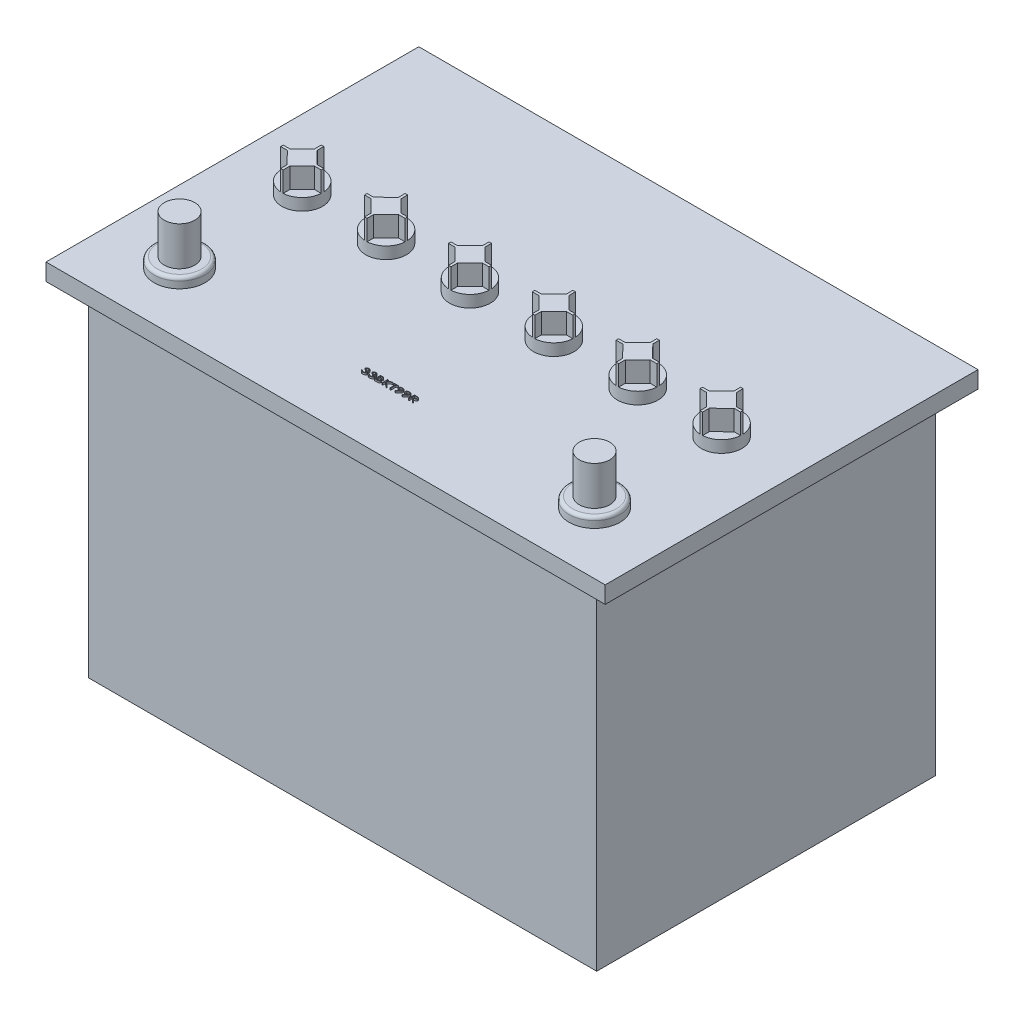
from build123d import *

# Parameters (mm, degrees)
SKETCH1_W           = 300
SKETCH1_H           = 200
BOSS_EXTRUDE1_DEPTH = 200
SKETCH2_W           = 330
SKETCH2_H           = 220
BOSS_EXTRUDE2_DEPTH = 10
SKETCH3_R           = 15
BOSS_EXTRUDE4_DEPTH = 6
FILLET1_R           = 2
SKETCH4_R           = 9
BOSS_EXTRUDE5_DEPTH = 23
SKETCH5_R           = 12
BOSS_EXTRUDE6_DEPTH = 7
BOSS_EXTRUDE7_DEPTH = 12
LPATTERN1_COUNT     = 6
LPATTERN1_PITCH     = 49.5
BOSS_EXTRUDE8_DEPTH = 1


with BuildPart() as part:
    # Sketch1 → Boss-Extrude1 (new body)
    with BuildSketch(Plane(origin=(0, 0, 0), x_dir=(1, 0, 0), z_dir=(0, 1, 0))):
        Rectangle(SKETCH1_W, SKETCH1_H)
    extrude(amount=BOSS_EXTRUDE1_DEPTH)

    # Sketch2 → Boss-Extrude2 (add)
    with BuildSketch(Plane(origin=(0, 200, 0), x_dir=(1, 0, 0), z_dir=(0, 1, 0))):
        Rectangle(SKETCH2_W, SKETCH2_H)
    extrude(amount=BOSS_EXTRUDE2_DEPTH)

    # Sketch3 → Boss-Extrude4 (add)
    with BuildSketch(Plane(origin=(0, 210, 0), x_dir=(1, 0, 0), z_dir=(0, 1, 0))):
        with Locations((-122.450147056, -73.740696293)):
            Circle(SKETCH3_R)
        with Locations((122.450147056, -73.740696293)):
            Circle(SKETCH3_R)
    extrude(amount=BOSS_EXTRUDE4_DEPTH)

    # Fillet1
    fillet1_edges = [part.edges().sort_by_distance(p)[0] for p in [
        (-137.450147056, 216, 73.740696293),
        (107.450147056, 216, 73.740696293),
    ]]
    fillet(fillet1_edges, radius=FILLET1_R)

    # Sketch4 → Boss-Extrude5 (add)
    with BuildSketch(Plane(origin=(0, 216, 0), x_dir=(1, 0, 0), z_dir=(0, 1, 0))):
        with Locations((-122.450147056, -73.740696293)):
            Circle(SKETCH4_R)
        with Locations((122.450147056, -73.740696293)):
            Circle(SKETCH4_R)
    extrude(amount=BOSS_EXTRUDE5_DEPTH)

    # Sketch5 → Boss-Extrude6 (add)
    with BuildSketch(Plane(origin=(0, 210, 0), x_dir=(1, 0, 0), z_dir=(0, 1, 0))):
        with Locations((-123.803187355, 0)):
            Circle(SKETCH5_R)
    boss_extrude6 = extrude(amount=BOSS_EXTRUDE6_DEPTH)

    # Sketch6 → Boss-Extrude7 (add)
    with BuildSketch(Plane(origin=(0, 217, 0), x_dir=(1, 0, 0), z_dir=(0, 1, 0))):
        with BuildLine():
            Line((-123.053187355, -11.976539567), (-123.053187355, -8.050654788))
            Line((-123.053187355, -8.050654788), (-115.67552533, -0.75))
            Line((-115.67552533, -0.75), (-111.826647788, -0.75))
            ThreePointArc((-111.826647788, -0.75), (-111.809053897, -0.375183419), (-111.803187355, 0))
            ThreePointArc((-111.803187355, 0), (-111.809053897, 0.375183419), (-111.826647788, 0.75))
            Line((-111.826647788, 0.75), (-115.752532567, 0.75))
            Line((-115.752532567, 0.75), (-123.053187355, 8.127662025))
            Line((-123.053187355, 8.127662025), (-123.053187355, 11.976539567))
            ThreePointArc((-123.053187355, 11.976539567), (-123.803187355, 12), (-124.553187355, 11.976539567))
            Line((-124.553187355, 11.976539567), (-124.553187355, 8.050654788))
            Line((-124.553187355, 8.050654788), (-131.93084938, 0.75))
            Line((-131.93084938, 0.75), (-135.779726922, 0.75))
            ThreePointArc((-135.779726922, 0.75), (-135.803187355, 0), (-135.779726922, -0.75))
            Line((-135.779726922, -0.75), (-131.853842143, -0.75))
            Line((-131.853842143, -0.75), (-124.553187355, -8.127662025))
            Line((-124.553187355, -8.127662025), (-124.553187355, -11.976539567))
            ThreePointArc((-124.553187355, -11.976539567), (-123.803187355, -12), (-123.053187355, -11.976539567))
        make_face()
    boss_extrude7 = extrude(amount=BOSS_EXTRUDE7_DEPTH)

    # LPattern1: Boss-Extrude6, Boss-Extrude7 ×6
    with Locations(*[(i * LPATTERN1_PITCH, 0, 0) for i in range(1, LPATTERN1_COUNT)]):
        add(boss_extrude6)
        add(boss_extrude7)

    # Sketch7 → Boss-Extrude8 (add)
    # profile 1 of 8: a face of its own
    with BuildSketch(Plane(origin=(0, 210, 0), x_dir=(1, 0, 0), z_dir=(0, 1, 0))):
        with BuildLine():
            Line((-15.233974359, -71.048388601), (-15.682692308, -71.048388601))
            add(Edge.make_bspline(
                [(-15.682692308, -71.048388601), (-15.670740797, -71.013071054), (-15.647217894, -70.943559232), (-15.600733136, -70.844818085), (-15.547640338, -70.751918802), (-15.486285946, -70.665359307), (-15.417359401, -70.584735136), (-15.339582974, -70.511439047), (-15.255587111, -70.442769775), (-15.163224815, -70.382241602), (-15.065619562, -70.327641954), (-14.962597136, -70.280538044), (-14.855216605, -70.240691164), (-14.743774295, -70.207625051), (-14.62797021, -70.182406737), (-14.507828051, -70.164378443), (-14.383276247, -70.152727645), (-14.298704059, -70.151549075), (-14.255909455, -70.150952704)],
                knots=[0, 0, 0, 0, 0.987395802, 1.943387521, 2.886756667, 3.819863718, 4.750954218, 5.692797287, 6.648467947, 7.622447263, 8.61503523, 9.609958543, 10.621192064, 11.648084714, 12.688006362, 13.75927082, 14.866162522, 16, 16, 16, 16], degree=3))
            add(Edge.make_bspline(
                [(-14.255909455, -70.150952704), (-14.193431167, -70.152332866), (-14.070110236, -70.155057058), (-13.888705216, -70.179717869), (-13.713907524, -70.218986922), (-13.573717582, -70.264192906), (-13.467207174, -70.308617612), (-13.391067042, -70.34305882), (-13.320581247, -70.382049974), (-13.253954014, -70.422332564), (-13.193235137, -70.467034288), (-13.136011237, -70.512959487), (-13.084020891, -70.562457436), (-13.036508428, -70.613841595), (-12.99437224, -70.667480536), (-12.9571602, -70.721597028), (-12.926271008, -70.776977642), (-12.899788925, -70.832162217), (-12.880367591, -70.888492364), (-12.866036971, -70.945214623), (-12.857433592, -71.00255075), (-12.856322276, -71.041115824), (-12.855769231, -71.060307672)],
                knots=[0, 0, 0, 0, 2.043593356, 4.033686668, 5.977997248, 7.900604975, 8.843597342, 9.753736761, 10.633223357, 11.477908549, 12.299356845, 13.098393349, 13.877379877, 14.645936116, 15.386433903, 16.107606327, 16.792466876, 17.459591995, 18.107775728, 18.73839817, 19.37216588, 20, 20, 20, 20], degree=3))
            add(Edge.make_bspline(
                [(-12.855769231, -71.060307672), (-12.857528191, -71.097388075), (-12.860993248, -71.170434463), (-12.888477863, -71.277100118), (-12.935277209, -71.37670339), (-12.998256646, -71.471588005), (-13.081353294, -71.558500712), (-13.181089744, -71.640240904), (-13.299268446, -71.715488868), (-13.386516322, -71.758100851), (-13.432091346, -71.780359755)],
                knots=[0, 0, 0, 0, 0.909006552, 1.790693694, 2.680934351, 3.598526391, 4.572130129, 5.619037134, 6.756274147, 8, 8, 8, 8], degree=3))
            add(Edge.make_bspline(
                [(-13.432091346, -71.780359755), (-13.381608431, -71.798167835), (-13.283172935, -71.832891407), (-13.146581206, -71.902630867), (-13.022688891, -71.982610047), (-12.951274694, -72.047195428), (-12.916065705, -72.07903764)],
                knots=[0, 0, 0, 0, 1.067287181, 2.081079182, 3.053923925, 4, 4, 4, 4], degree=3))
            add(Edge.make_bspline(
                [(-12.916065705, -72.07903764), (-12.893443498, -72.102023386), (-12.848997983, -72.147183142), (-12.790942333, -72.219958984), (-12.742100658, -72.295328123), (-12.7010375, -72.371923819), (-12.670156065, -72.451401902), (-12.647352029, -72.532557337), (-12.633699365, -72.616099838), (-12.632174642, -72.672605068), (-12.631410256, -72.700932672)],
                knots=[0, 0, 0, 0, 1.099948183, 2.161051958, 3.169675653, 4.161353964, 5.12096266, 6.072886245, 7.033885631, 8, 8, 8, 8], degree=3))
            add(Edge.make_bspline(
                [(-12.631410256, -72.700932672), (-12.632142692, -72.725502491), (-12.633606302, -72.774599847), (-12.643661295, -72.847866306), (-12.660418145, -72.920202344), (-12.684694428, -72.991680043), (-12.715573059, -73.062179679), (-12.75271237, -73.132056865), (-12.797722365, -73.200094761), (-12.847443587, -73.267975359), (-12.904314459, -73.332824059), (-12.966189264, -73.394321215), (-13.031835415, -73.453269821), (-13.104283818, -73.506080252), (-13.180322867, -73.556959526), (-13.262146423, -73.60299174), (-13.348330533, -73.64598609), (-13.439345179, -73.68417656), (-13.534111238, -73.718576363), (-13.631901511, -73.748613478), (-13.732507758, -73.773988779), (-13.836005107, -73.794197841), (-13.942225468, -73.810171188), (-14.051189368, -73.822243308), (-14.162796001, -73.829402434), (-14.238137342, -73.830091421), (-14.276241987, -73.830439883)],
                knots=[0, 0, 0, 0, 0.802535276, 1.603689438, 2.411112196, 3.224719437, 4.065802075, 4.923117297, 5.80615366, 6.728417717, 7.669976847, 8.620101664, 9.577468368, 10.54858692, 11.545910617, 12.564828854, 13.613015613, 14.69067659, 15.787130798, 16.905245909, 18.031049677, 19.174957855, 20.348618168, 21.539068275, 22.755358892, 24, 24, 24, 24], degree=3))
            add(Edge.make_bspline(
                [(-14.276241987, -73.830439883), (-14.327209222, -73.829574753), (-14.427182358, -73.827877784), (-14.573865178, -73.816266057), (-14.713815863, -73.794930896), (-14.847336002, -73.766316771), (-14.974724244, -73.730049776), (-15.095698636, -73.685075325), (-15.210290082, -73.631911008), (-15.317631405, -73.570074758), (-15.41756534, -73.500951749), (-15.508410665, -73.423180439), (-15.591030213, -73.338495553), (-15.663154614, -73.245007681), (-15.727840798, -73.145031412), (-15.782021456, -73.036650775), (-15.82854396, -72.920959609), (-15.850820967, -72.83978011), (-15.862179487, -72.798388601)],
                knots=[0, 0, 0, 0, 1.190413464, 2.335017149, 3.433541733, 4.494537452, 5.522499046, 6.524257344, 7.505961173, 8.46940599, 9.414302072, 10.339698554, 11.258454567, 12.172381962, 13.09300084, 14.035291832, 14.998241702, 16, 16, 16, 16], degree=3))
            Line((-15.862179487, -72.798388601), (-15.413461538, -72.798388601))
            add(Edge.make_bspline(
                [(-15.413461538, -72.798388601), (-15.402610397, -72.825426573), (-15.381361657, -72.878372414), (-15.34391811, -72.953479581), (-15.303593137, -73.023129294), (-15.25900034, -73.086272843), (-15.212134598, -73.144604283), (-15.160610716, -73.196051413), (-15.10682979, -73.243466551), (-15.067213045, -73.269294928), (-15.047475962, -73.28216264)],
                knots=[0, 0, 0, 0, 1.132145232, 2.216970274, 3.259385698, 4.257467278, 5.219503243, 6.163874548, 7.085241318, 8, 8, 8, 8], degree=3))
            add(Edge.make_bspline(
                [(-15.047475962, -73.28216264), (-15.02130278, -73.297336282), (-14.968424688, -73.327991832), (-14.883568649, -73.366253318), (-14.794044159, -73.399625783), (-14.698713433, -73.424788154), (-14.598948926, -73.446462119), (-14.493439366, -73.460565593), (-14.382757357, -73.470150658), (-14.30711319, -73.471021392), (-14.268529647, -73.471465524)],
                knots=[0, 0, 0, 0, 0.893867431, 1.805894493, 2.74799246, 3.71511807, 4.717865955, 5.764337694, 6.859663948, 8, 8, 8, 8], degree=3))
            add(Edge.make_bspline(
                [(-14.268529647, -73.471465524), (-14.224799894, -73.470856874), (-14.13954535, -73.469670262), (-14.015062193, -73.458576646), (-13.896825604, -73.442545327), (-13.785476264, -73.417568613), (-13.680300106, -73.387393102), (-13.582607911, -73.348225483), (-13.490839971, -73.303568087), (-13.406512402, -73.251885636), (-13.330632469, -73.195617139), (-13.264190838, -73.136493819), (-13.207361436, -73.075290436), (-13.160773847, -73.011400329), (-13.124179195, -72.944844781), (-13.099128307, -72.875486708), (-13.082707311, -72.804062462), (-13.080990297, -72.755475733), (-13.080128205, -72.731080909)],
                knots=[0, 0, 0, 0, 1.360353189, 2.652113973, 3.886216181, 5.070148789, 6.199935678, 7.286998849, 8.340713861, 9.372136105, 10.359685652, 11.276421392, 12.135904893, 12.953384407, 13.731082342, 14.490303206, 15.241999049, 16, 16, 16, 16], degree=3))
            add(Edge.make_bspline(
                [(-13.080128205, -72.731080909), (-13.081907608, -72.698339738), (-13.085495534, -72.632321603), (-13.118784192, -72.536242774), (-13.170096625, -72.443626677), (-13.241811825, -72.35670147), (-13.328949121, -72.275929202), (-13.430962511, -72.204459593), (-13.547276758, -72.145018132), (-13.654364126, -72.104566674), (-13.749592727, -72.076842672), (-13.831503524, -72.058025465), (-13.922911694, -72.042496001), (-14.023374468, -72.027510777), (-14.133302373, -72.015173675), (-14.252531119, -72.00474647), (-14.381101131, -71.996296645), (-14.469975677, -71.992607703), (-14.516025641, -71.990696293)],
                knots=[0, 0, 0, 0, 0.882729801, 1.779905068, 2.718893252, 3.73432288, 4.811844334, 5.923218651, 7.090383321, 8.334298397, 9.012158468, 9.770864905, 10.605040525, 11.5182922, 12.516811851, 13.595148151, 14.753936343, 16, 16, 16, 16], degree=3))
            Line((-14.516025641, -71.990696293), (-14.516025641, -71.631721934))
            add(Edge.make_bspline(
                [(-14.516025641, -71.631721934), (-14.457785961, -71.630978356), (-14.34364219, -71.62952102), (-14.176551432, -71.612253104), (-14.017002894, -71.588060297), (-13.890297612, -71.55756793), (-13.795044002, -71.527756888), (-13.728384908, -71.50615012), (-13.66763716, -71.481211903), (-13.611397771, -71.456126668), (-13.560793215, -71.428822555), (-13.514422133, -71.400930038), (-13.474038742, -71.370588481), (-13.426779283, -71.330474233), (-13.37946198, -71.276088493), (-13.33539176, -71.207491482), (-13.309599023, -71.134049468), (-13.306184969, -71.08386292), (-13.304487179, -71.058905428)],
                knots=[0, 0, 0, 0, 1.917665882, 3.758427453, 5.527810254, 7.230694856, 8.044036591, 8.815763194, 9.537693509, 10.206039437, 10.843197722, 11.430754734, 11.98658976, 12.505134745, 13.470512697, 14.348572317, 15.178754166, 16, 16, 16, 16], degree=3))
            add(Edge.make_bspline(
                [(-13.304487179, -71.058905428), (-13.305308045, -71.040611159), (-13.306948433, -71.004052537), (-13.319847554, -70.950422633), (-13.341854614, -70.89918333), (-13.370171945, -70.848888171), (-13.409228766, -70.801813261), (-13.455579443, -70.75634835), (-13.510126643, -70.712398299), (-13.573061027, -70.671968535), (-13.641513759, -70.633382023), (-13.715637782, -70.600626763), (-13.793862499, -70.572430734), (-13.876544531, -70.549276263), (-13.96379376, -70.53200663), (-14.055327524, -70.519418955), (-14.151308041, -70.511618119), (-14.216865554, -70.510498221), (-14.250300481, -70.509927063)],
                knots=[0, 0, 0, 0, 0.732615433, 1.464032802, 2.194490306, 2.962292955, 3.768159049, 4.635658689, 5.56145256, 6.569250306, 7.629836501, 8.707159465, 9.812091509, 10.959542366, 12.144148329, 13.37319213, 14.660304105, 16, 16, 16, 16], degree=3))
            add(Edge.make_bspline(
                [(-14.250300481, -70.509927063), (-14.303910912, -70.511294762), (-14.407922861, -70.513948296), (-14.557969535, -70.537609917), (-14.697110308, -70.575175359), (-14.804652501, -70.620194654), (-14.884118294, -70.665666283), (-14.941005073, -70.704425382), (-14.996264416, -70.748021558), (-15.048473221, -70.797845069), (-15.098356725, -70.852876135), (-15.146237131, -70.912733816), (-15.191981666, -70.978035702), (-15.219775192, -71.024599878), (-15.233974359, -71.048388601)],
                knots=[0, 0, 0, 0, 1.629182784, 3.160848974, 4.605547006, 6.003309027, 6.690807591, 7.386556579, 8.09460793, 8.828504166, 9.578025297, 10.351550949, 11.157839742, 12, 12, 12, 12], degree=3))
        make_face()
    # profile 2 of 8: a face of its own
    with BuildSketch(Plane(origin=(0, 210, 0), x_dir=(1, 0, 0), z_dir=(0, 1, 0))):
        with BuildLine():
            Line((-11.150641026, -71.048388601), (-11.599358974, -71.048388601))
            add(Edge.make_bspline(
                [(-11.599358974, -71.048388601), (-11.587407464, -71.013071054), (-11.563884561, -70.943559232), (-11.517399803, -70.844818085), (-11.464307005, -70.751918802), (-11.402952613, -70.665359307), (-11.334026067, -70.584735136), (-11.256249641, -70.511439047), (-11.172253778, -70.442769775), (-11.079891481, -70.382241602), (-10.982286228, -70.327641954), (-10.879263803, -70.280538044), (-10.771883272, -70.240691164), (-10.660440962, -70.207625051), (-10.544636876, -70.182406737), (-10.424494718, -70.164378443), (-10.299942914, -70.152727645), (-10.215370725, -70.151549075), (-10.172576122, -70.150952704)],
                knots=[0, 0, 0, 0, 0.987395802, 1.943387521, 2.886756667, 3.819863718, 4.750954218, 5.692797287, 6.648467947, 7.622447263, 8.61503523, 9.609958543, 10.621192064, 11.648084714, 12.688006362, 13.75927082, 14.866162522, 16, 16, 16, 16], degree=3))
            add(Edge.make_bspline(
                [(-10.172576122, -70.150952704), (-10.110097834, -70.152332866), (-9.986776903, -70.155057058), (-9.805371882, -70.179717869), (-9.63057419, -70.218986922), (-9.490384248, -70.264192906), (-9.38387384, -70.308617612), (-9.307733709, -70.34305882), (-9.237247913, -70.382049974), (-9.170620681, -70.422332564), (-9.109901803, -70.467034288), (-9.052677904, -70.512959487), (-9.000687558, -70.562457436), (-8.953175095, -70.613841595), (-8.911038907, -70.667480536), (-8.873826867, -70.721597028), (-8.842937675, -70.776977642), (-8.816455592, -70.832162217), (-8.797034257, -70.888492364), (-8.782703638, -70.945214623), (-8.774100259, -71.00255075), (-8.772988942, -71.041115824), (-8.772435897, -71.060307672)],
                knots=[0, 0, 0, 0, 2.043593356, 4.033686668, 5.977997248, 7.900604975, 8.843597342, 9.753736761, 10.633223357, 11.477908549, 12.299356845, 13.098393349, 13.877379877, 14.645936116, 15.386433903, 16.107606327, 16.792466876, 17.459591995, 18.107775728, 18.73839817, 19.37216588, 20, 20, 20, 20], degree=3))
            add(Edge.make_bspline(
                [(-8.772435897, -71.060307672), (-8.774194858, -71.097388075), (-8.777659915, -71.170434463), (-8.805144529, -71.277100118), (-8.851943876, -71.37670339), (-8.914923312, -71.471588005), (-8.998019961, -71.558500712), (-9.097756411, -71.640240904), (-9.215935113, -71.715488868), (-9.303182989, -71.758100851), (-9.348758013, -71.780359755)],
                knots=[0, 0, 0, 0, 0.909006552, 1.790693694, 2.680934351, 3.598526391, 4.572130129, 5.619037134, 6.756274147, 8, 8, 8, 8], degree=3))
            add(Edge.make_bspline(
                [(-9.348758013, -71.780359755), (-9.298275098, -71.798167835), (-9.199839601, -71.832891407), (-9.063247873, -71.902630867), (-8.939355557, -71.982610047), (-8.867941361, -72.047195428), (-8.832732372, -72.07903764)],
                knots=[0, 0, 0, 0, 1.067287181, 2.081079182, 3.053923925, 4, 4, 4, 4], degree=3))
            add(Edge.make_bspline(
                [(-8.832732372, -72.07903764), (-8.810110165, -72.102023386), (-8.76566465, -72.147183142), (-8.707609, -72.219958984), (-8.658767325, -72.295328123), (-8.617704167, -72.371923819), (-8.586822731, -72.451401902), (-8.564018696, -72.532557337), (-8.550366031, -72.616099838), (-8.548841308, -72.672605068), (-8.548076923, -72.700932672)],
                knots=[0, 0, 0, 0, 1.099948183, 2.161051958, 3.169675653, 4.161353964, 5.12096266, 6.072886245, 7.033885631, 8, 8, 8, 8], degree=3))
            add(Edge.make_bspline(
                [(-8.548076923, -72.700932672), (-8.548809358, -72.725502491), (-8.550272968, -72.774599847), (-8.560327962, -72.847866306), (-8.577084811, -72.920202344), (-8.601361095, -72.991680043), (-8.632239726, -73.062179679), (-8.669379037, -73.132056865), (-8.714389032, -73.200094761), (-8.764110254, -73.267975359), (-8.820981125, -73.332824059), (-8.882855931, -73.394321215), (-8.948502081, -73.453269821), (-9.020950485, -73.506080252), (-9.096989534, -73.556959526), (-9.17881309, -73.60299174), (-9.264997199, -73.64598609), (-9.356011845, -73.68417656), (-9.450777905, -73.718576363), (-9.548568177, -73.748613478), (-9.649174425, -73.773988779), (-9.752671774, -73.794197841), (-9.858892135, -73.810171188), (-9.967856035, -73.822243308), (-10.079462668, -73.829402434), (-10.154804009, -73.830091421), (-10.192908654, -73.830439883)],
                knots=[0, 0, 0, 0, 0.802535276, 1.603689438, 2.411112196, 3.224719437, 4.065802075, 4.923117297, 5.80615366, 6.728417717, 7.669976847, 8.620101664, 9.577468368, 10.54858692, 11.545910617, 12.564828854, 13.613015613, 14.69067659, 15.787130798, 16.905245909, 18.031049677, 19.174957855, 20.348618168, 21.539068275, 22.755358892, 24, 24, 24, 24], degree=3))
            add(Edge.make_bspline(
                [(-10.192908654, -73.830439883), (-10.243875889, -73.829574753), (-10.343849025, -73.827877784), (-10.490531845, -73.816266057), (-10.630482529, -73.794930896), (-10.764002669, -73.766316771), (-10.891390911, -73.730049776), (-11.012365302, -73.685075325), (-11.126956749, -73.631911008), (-11.234298072, -73.570074758), (-11.334232007, -73.500951749), (-11.425077332, -73.423180439), (-11.50769688, -73.338495553), (-11.579821281, -73.245007681), (-11.644507464, -73.145031412), (-11.698688123, -73.036650775), (-11.745210626, -72.920959609), (-11.767487634, -72.83978011), (-11.778846154, -72.798388601)],
                knots=[0, 0, 0, 0, 1.190413464, 2.335017149, 3.433541733, 4.494537452, 5.522499046, 6.524257344, 7.505961173, 8.46940599, 9.414302072, 10.339698554, 11.258454567, 12.172381962, 13.09300084, 14.035291832, 14.998241702, 16, 16, 16, 16], degree=3))
            Line((-11.778846154, -72.798388601), (-11.330128205, -72.798388601))
            add(Edge.make_bspline(
                [(-11.330128205, -72.798388601), (-11.319277063, -72.825426573), (-11.298028324, -72.878372414), (-11.260584777, -72.953479581), (-11.220259803, -73.023129294), (-11.175667007, -73.086272843), (-11.128801265, -73.144604283), (-11.077277383, -73.196051413), (-11.023496456, -73.243466551), (-10.983879712, -73.269294928), (-10.964142628, -73.28216264)],
                knots=[0, 0, 0, 0, 1.132145232, 2.216970274, 3.259385698, 4.257467278, 5.219503243, 6.163874548, 7.085241318, 8, 8, 8, 8], degree=3))
            add(Edge.make_bspline(
                [(-10.964142628, -73.28216264), (-10.937969447, -73.297336282), (-10.885091355, -73.327991832), (-10.800235315, -73.366253318), (-10.710710826, -73.399625783), (-10.615380099, -73.424788154), (-10.515615592, -73.446462119), (-10.410106033, -73.460565593), (-10.299424024, -73.470150658), (-10.223779856, -73.471021392), (-10.185196314, -73.471465524)],
                knots=[0, 0, 0, 0, 0.893867431, 1.805894493, 2.74799246, 3.71511807, 4.717865955, 5.764337694, 6.859663948, 8, 8, 8, 8], degree=3))
            add(Edge.make_bspline(
                [(-10.185196314, -73.471465524), (-10.141466561, -73.470856874), (-10.056212017, -73.469670262), (-9.93172886, -73.458576646), (-9.813492271, -73.442545327), (-9.70214293, -73.417568613), (-9.596966773, -73.387393102), (-9.499274577, -73.348225483), (-9.407506637, -73.303568087), (-9.323179069, -73.251885636), (-9.247299136, -73.195617139), (-9.180857505, -73.136493819), (-9.124028103, -73.075290436), (-9.077440513, -73.011400329), (-9.040845861, -72.944844781), (-9.015794973, -72.875486708), (-8.999373977, -72.804062462), (-8.997656964, -72.755475733), (-8.996794872, -72.731080909)],
                knots=[0, 0, 0, 0, 1.360353189, 2.652113973, 3.886216181, 5.070148789, 6.199935678, 7.286998849, 8.340713861, 9.372136105, 10.359685652, 11.276421392, 12.135904893, 12.953384407, 13.731082342, 14.490303206, 15.241999049, 16, 16, 16, 16], degree=3))
            add(Edge.make_bspline(
                [(-8.996794872, -72.731080909), (-8.998574275, -72.698339738), (-9.002162201, -72.632321603), (-9.035450859, -72.536242774), (-9.086763291, -72.443626677), (-9.158478491, -72.35670147), (-9.245615788, -72.275929202), (-9.347629178, -72.204459593), (-9.463943425, -72.145018132), (-9.571030793, -72.104566674), (-9.666259393, -72.076842672), (-9.748170191, -72.058025465), (-9.839578361, -72.042496001), (-9.940041135, -72.027510777), (-10.04996904, -72.015173675), (-10.169197785, -72.00474647), (-10.297767798, -71.996296645), (-10.386642344, -71.992607703), (-10.432692308, -71.990696293)],
                knots=[0, 0, 0, 0, 0.882729801, 1.779905068, 2.718893252, 3.73432288, 4.811844334, 5.923218651, 7.090383321, 8.334298397, 9.012158468, 9.770864905, 10.605040525, 11.5182922, 12.516811851, 13.595148151, 14.753936343, 16, 16, 16, 16], degree=3))
            Line((-10.432692308, -71.990696293), (-10.432692308, -71.631721934))
            add(Edge.make_bspline(
                [(-10.432692308, -71.631721934), (-10.374452627, -71.630978356), (-10.260308857, -71.62952102), (-10.093218099, -71.612253104), (-9.93366956, -71.588060297), (-9.806964278, -71.55756793), (-9.711710669, -71.527756888), (-9.645051575, -71.50615012), (-9.584303827, -71.481211903), (-9.528064438, -71.456126668), (-9.477459882, -71.428822555), (-9.431088799, -71.400930038), (-9.390705408, -71.370588481), (-9.34344595, -71.330474233), (-9.296128646, -71.276088493), (-9.252058427, -71.207491482), (-9.22626569, -71.134049468), (-9.222851636, -71.08386292), (-9.221153846, -71.058905428)],
                knots=[0, 0, 0, 0, 1.917665882, 3.758427453, 5.527810254, 7.230694856, 8.044036591, 8.815763194, 9.537693509, 10.206039437, 10.843197722, 11.430754734, 11.98658976, 12.505134745, 13.470512697, 14.348572317, 15.178754166, 16, 16, 16, 16], degree=3))
            add(Edge.make_bspline(
                [(-9.221153846, -71.058905428), (-9.221974712, -71.040611159), (-9.2236151, -71.004052537), (-9.23651422, -70.950422633), (-9.258521281, -70.89918333), (-9.286838612, -70.848888171), (-9.325895433, -70.801813261), (-9.37224611, -70.75634835), (-9.426793309, -70.712398299), (-9.489727694, -70.671968535), (-9.558180425, -70.633382023), (-9.632304449, -70.600626763), (-9.710529165, -70.572430734), (-9.793211198, -70.549276263), (-9.880460427, -70.53200663), (-9.971994191, -70.519418955), (-10.067974708, -70.511618119), (-10.13353222, -70.510498221), (-10.166967147, -70.509927063)],
                knots=[0, 0, 0, 0, 0.732615433, 1.464032802, 2.194490306, 2.962292955, 3.768159049, 4.635658689, 5.56145256, 6.569250306, 7.629836501, 8.707159465, 9.812091509, 10.959542366, 12.144148329, 13.37319213, 14.660304105, 16, 16, 16, 16], degree=3))
            add(Edge.make_bspline(
                [(-10.166967147, -70.509927063), (-10.220577579, -70.511294762), (-10.324589528, -70.513948296), (-10.474636201, -70.537609917), (-10.613776975, -70.575175359), (-10.721319167, -70.620194654), (-10.800784961, -70.665666283), (-10.85767174, -70.704425382), (-10.912931083, -70.748021558), (-10.965139887, -70.797845069), (-11.015023392, -70.852876135), (-11.062903797, -70.912733816), (-11.108648333, -70.978035702), (-11.136441859, -71.024599878), (-11.150641026, -71.048388601)],
                knots=[0, 0, 0, 0, 1.629182784, 3.160848974, 4.605547006, 6.003309027, 6.690807591, 7.386556579, 8.09460793, 8.828504166, 9.578025297, 10.351550949, 11.157839742, 12, 12, 12, 12], degree=3))
        make_face()
    # profile 3 of 8: a face of its own
    with BuildSketch(Plane(origin=(0, 210, 0), x_dir=(1, 0, 0), z_dir=(0, 1, 0))):
        with BuildLine():
            Line((-7.336538462, -70.240696293), (-6.414563301, -70.240696293))
            add(Edge.make_bspline(
                [(-6.414563301, -70.240696293), (-6.369451655, -70.240872638), (-6.282003879, -70.241214478), (-6.154840292, -70.246487218), (-6.035779094, -70.253696293), (-5.924735424, -70.265096365), (-5.821807179, -70.278899434), (-5.726741792, -70.295529648), (-5.639786042, -70.315528727), (-5.536439644, -70.347059349), (-5.418999494, -70.393971395), (-5.290820772, -70.462937728), (-5.180018362, -70.54825457), (-5.100067898, -70.629329792), (-5.045604905, -70.699515157), (-5.010520653, -70.753868991), (-4.980106435, -70.808892151), (-4.955919437, -70.866061824), (-4.937401497, -70.924594938), (-4.922768758, -70.984444788), (-4.915295722, -71.045860528), (-4.914076146, -71.087167322), (-4.913461538, -71.107983954)],
                knots=[0, 0, 0, 0, 1.39724725, 2.708528202, 3.94177167, 5.091420438, 6.165392027, 7.158012234, 8.079899669, 8.927230328, 10.502741213, 11.989888587, 13.420420648, 14.817967921, 15.504322172, 16.168953279, 16.820082069, 17.449354364, 18.088091176, 18.720230141, 19.355057751, 20, 20, 20, 20], degree=3))
            add(Edge.make_bspline(
                [(-4.913461538, -71.107983954), (-4.915211592, -71.146702841), (-4.918669637, -71.223210011), (-4.946464376, -71.335108624), (-4.991829926, -71.441413207), (-5.055522463, -71.541578877), (-5.137198753, -71.633597634), (-5.234852463, -71.717922099), (-5.350514132, -71.791759387), (-5.435761337, -71.831807542), (-5.479967949, -71.8525753)],
                knots=[0, 0, 0, 0, 0.934085894, 1.845721114, 2.766101278, 3.714903953, 4.698679118, 5.727076188, 6.821330726, 8, 8, 8, 8], degree=3))
            add(Edge.make_bspline(
                [(-5.479967949, -71.8525753), (-5.450471922, -71.860102174), (-5.393103226, -71.87474167), (-5.31026215, -71.899156838), (-5.23322948, -71.925665656), (-5.160427502, -71.950859131), (-5.093737127, -71.979317966), (-5.031438071, -72.007126122), (-4.974616933, -72.036341289), (-4.9071123, -72.07741495), (-4.830315722, -72.13114583), (-4.747604632, -72.202417655), (-4.676900514, -72.281157008), (-4.616704488, -72.365608697), (-4.568847799, -72.45501617), (-4.534681945, -72.549176838), (-4.513776832, -72.6469618), (-4.511006922, -72.713686024), (-4.509615385, -72.74720671)],
                knots=[0, 0, 0, 0, 1.021636669, 1.98704607, 2.897351675, 3.755795132, 4.571537239, 5.329741036, 6.04540914, 6.713964461, 7.980493183, 9.186915536, 10.369854974, 11.523301854, 12.660174704, 13.761868922, 14.875615405, 16, 16, 16, 16], degree=3))
            add(Edge.make_bspline(
                [(-4.509615385, -72.74720671), (-4.510723152, -72.781430626), (-4.512912147, -72.849058502), (-4.533553079, -72.948041777), (-4.565717777, -73.043017977), (-4.612118962, -73.133673355), (-4.671749323, -73.220141103), (-4.743430644, -73.303194005), (-4.828842116, -73.381267181), (-4.925517465, -73.455080757), (-5.033544898, -73.522101479), (-5.150839736, -73.58143022), (-5.277777256, -73.629903936), (-5.413079299, -73.67101126), (-5.557353385, -73.702089416), (-5.710562291, -73.724203761), (-5.872312994, -73.738809108), (-5.983340321, -73.74005741), (-6.040164263, -73.740696293)],
                knots=[0, 0, 0, 0, 0.811319057, 1.603200086, 2.388997432, 3.185236886, 4.011360337, 4.87646457, 5.783118581, 6.752669429, 7.759193782, 8.796024263, 9.867222007, 10.979669328, 12.149181771, 13.365777962, 14.651801457, 16, 16, 16, 16], degree=3))
            Line((-6.040164263, -73.740696293), (-7.336538462, -73.740696293))
            Line((-7.336538462, -73.740696293), (-7.336538462, -70.240696293))
        make_face()
        with BuildLine():
            Line((-6.887820513, -70.599670652), (-6.887820513, -71.721465524))
            Line((-6.887820513, -71.721465524), (-6.612279647, -71.721465524))
            add(Edge.make_bspline(
                [(-6.612279647, -71.721465524), (-6.571848527, -71.721068629), (-6.49378166, -71.72030228), (-6.380607603, -71.718047938), (-6.275924834, -71.711982486), (-6.179292354, -71.705541011), (-6.091130845, -71.695724424), (-6.011229884, -71.683634288), (-5.939377099, -71.671041365), (-5.856601402, -71.649452594), (-5.763187991, -71.618281245), (-5.662969989, -71.56886163), (-5.574629479, -71.510355095), (-5.499651163, -71.442572781), (-5.438574289, -71.367656444), (-5.394664893, -71.287135414), (-5.366647346, -71.20212), (-5.363676362, -71.143718534), (-5.362179487, -71.11429405)],
                knots=[0, 0, 0, 0, 1.259553817, 2.432023108, 3.525600822, 4.525637774, 5.44858436, 6.287701099, 7.043051776, 7.719324451, 8.951051145, 10.103619779, 11.189927722, 12.241351846, 13.240752608, 14.18549336, 15.085794811, 16, 16, 16, 16], degree=3))
            add(Edge.make_bspline(
                [(-5.362179487, -71.11429405), (-5.362749233, -71.094831617), (-5.363871276, -71.05650279), (-5.375818865, -71.001003977), (-5.393120748, -70.94815207), (-5.418646835, -70.898692091), (-5.452025351, -70.85288781), (-5.492618697, -70.810571473), (-5.53980522, -70.771204841), (-5.594501936, -70.735076261), (-5.657095475, -70.703120018), (-5.727818615, -70.67466008), (-5.80748128, -70.652405977), (-5.895324961, -70.632231422), (-5.992011145, -70.618498658), (-6.096941006, -70.606767402), (-6.210469362, -70.600863141), (-6.28905747, -70.600077321), (-6.329727564, -70.599670652)],
                knots=[0, 0, 0, 0, 0.76343715, 1.503493918, 2.220642451, 2.943352854, 3.679812797, 4.439652855, 5.241383576, 6.089358711, 7.009195052, 7.998061397, 9.078895104, 10.255009753, 11.536628368, 12.912520766, 14.402200096, 16, 16, 16, 16], degree=3))
            Line((-6.329727564, -70.599670652), (-6.887820513, -70.599670652))
        make_face(mode=Mode.SUBTRACT)
        with BuildLine():
            Line((-6.887820513, -72.080439883), (-6.887820513, -73.381721934))
            Line((-6.887820513, -73.381721934), (-6.286258013, -73.381721934))
            add(Edge.make_bspline(
                [(-6.286258013, -73.381721934), (-6.243488681, -73.381338341), (-6.160746019, -73.38059623), (-6.041046389, -73.37816082), (-5.930197603, -73.372780727), (-5.828573473, -73.363966108), (-5.735624501, -73.354762979), (-5.651677826, -73.342087903), (-5.576301598, -73.327534759), (-5.488943392, -73.305697864), (-5.390768318, -73.27115711), (-5.284211274, -73.219426544), (-5.189599056, -73.157280483), (-5.108601698, -73.085513527), (-5.042361265, -73.007131683), (-4.994323967, -72.923669076), (-4.963293653, -72.836758511), (-4.95997796, -72.776898211), (-4.958333333, -72.74720671)],
                knots=[0, 0, 0, 0, 1.263847441, 2.445072154, 3.537595439, 4.542368078, 5.45905404, 6.29702802, 7.050051565, 7.726719915, 8.956369896, 10.117642806, 11.218970155, 12.290268815, 13.305335944, 14.236423834, 15.125242873, 16, 16, 16, 16], degree=3))
            add(Edge.make_bspline(
                [(-4.958333333, -72.74720671), (-4.959069563, -72.728706973), (-4.960533691, -72.691916829), (-4.970385258, -72.637599097), (-4.987730083, -72.585312964), (-5.010504863, -72.534528413), (-5.041708481, -72.486300513), (-5.078692064, -72.439472437), (-5.122506181, -72.394516398), (-5.172554811, -72.351682836), (-5.228242517, -72.311554837), (-5.288955734, -72.273884998), (-5.355169734, -72.240638362), (-5.42595728, -72.209618961), (-5.502084891, -72.182241608), (-5.583173909, -72.15871948), (-5.669307198, -72.138219961), (-5.728576858, -72.127375285), (-5.759014423, -72.121806069)],
                knots=[0, 0, 0, 0, 0.805655859, 1.602195549, 2.393974285, 3.200080033, 4.018935358, 4.888408766, 5.795319674, 6.748019309, 7.753718868, 8.781879282, 9.856108523, 10.977378129, 12.14605498, 13.37634983, 14.652640814, 16, 16, 16, 16], degree=3))
            add(Edge.make_bspline(
                [(-5.759014423, -72.121806069), (-5.781426693, -72.118354585), (-5.829861011, -72.110895711), (-5.908489424, -72.102925999), (-5.998487884, -72.095871449), (-6.099970404, -72.090722497), (-6.212826609, -72.08531709), (-6.336969369, -72.083210066), (-6.472512954, -72.08071019), (-6.566705083, -72.080532481), (-6.615785256, -72.080439883)],
                knots=[0, 0, 0, 0, 0.633834236, 1.369755445, 2.208570154, 3.157344051, 4.210204252, 5.366899287, 6.627984704, 8, 8, 8, 8], degree=3))
            Line((-6.615785256, -72.080439883), (-6.887820513, -72.080439883))
        make_face(mode=Mode.SUBTRACT)
    # profile 4 of 8: a face of its own
    with BuildSketch(Plane(origin=(0, 210, 0), x_dir=(1, 0, 0), z_dir=(0, 1, 0))):
        Polygon((-3.118589744, -70.240696293), (-2.669871795, -70.240696293), (-2.669871795, -71.537771614), (-0.750200321, -70.240696293), (-0.08974359, -70.240696293), (-2.41396234, -71.811209114), (0.08974359, -73.740696293), (-0.529346955, -73.740696293), (-2.669871795, -72.090255588), (-2.669871795, -73.740696293), (-3.118589744, -73.740696293), align=None)
    # profile 5 of 8: a face of its own
    with BuildSketch(Plane(origin=(0, 210, 0), x_dir=(1, 0, 0), z_dir=(0, 1, 0))):
        Polygon((0.740384615, -70.599670652), (0.740384615, -70.240696293), (3.342948718, -70.240696293), (3.342948718, -70.599670652), (2.266025641, -70.599670652), (2.266025641, -73.740696293), (1.817307692, -73.740696293), (1.817307692, -70.599670652), align=None)
    # profile 6 of 8: a face of its own
    with BuildSketch(Plane(origin=(0, 210, 0), x_dir=(1, 0, 0), z_dir=(0, 1, 0))):
        with BuildLine():
            Line((5.137820513, -73.830439883), (4.752203526, -73.661469531))
            Line((4.752203526, -73.661469531), (6.081530449, -72.234686678))
            add(Edge.make_bspline(
                [(6.081530449, -72.234686678), (5.996747338, -72.242047386), (5.830881358, -72.256447555), (5.664411114, -72.258784606), (5.583032853, -72.259927063)],
                knots=[0, 0, 0, 0, 1.02230861, 2, 2, 2, 2], degree=3))
            add(Edge.make_bspline(
                [(5.583032853, -72.259927063), (5.534152251, -72.258972822), (5.438056407, -72.257096853), (5.296805111, -72.242658656), (5.160997618, -72.219961731), (5.030957376, -72.186785253), (4.906453895, -72.144686466), (4.787325814, -72.093546196), (4.674259282, -72.032137066), (4.567736386, -71.962878265), (4.470799778, -71.886334934), (4.385438734, -71.804770529), (4.312089455, -71.719282368), (4.253895544, -71.627986486), (4.207374789, -71.533125461), (4.174391574, -71.433663416), (4.153990001, -71.329672027), (4.151766213, -71.258818337), (4.150641026, -71.222967928)],
                knots=[0, 0, 0, 0, 1.197964924, 2.355115211, 3.476795506, 4.570267818, 5.640917617, 6.695523399, 7.743887008, 8.790982047, 9.806445658, 10.76669571, 11.681366556, 12.560116534, 13.4133049, 14.264741317, 15.121997258, 16, 16, 16, 16], degree=3))
            add(Edge.make_bspline(
                [(4.150641026, -71.222967928), (4.151116729, -71.19816643), (4.152058009, -71.149091447), (4.161482081, -71.07657488), (4.17692554, -71.005943409), (4.198813852, -70.937301851), (4.226286623, -70.87014652), (4.259957425, -70.804853848), (4.300186489, -70.741764245), (4.345920281, -70.680628298), (4.397098499, -70.621670322), (4.453874118, -70.565716807), (4.516009769, -70.512811145), (4.583456914, -70.463253408), (4.655605842, -70.416105177), (4.73312521, -70.372786005), (4.815436642, -70.331945051), (4.932170902, -70.281559596), (5.085289385, -70.229432071), (5.275697249, -70.18319929), (5.47265379, -70.156333957), (5.606090128, -70.152758411), (5.673477564, -70.150952704)],
                knots=[0, 0, 0, 0, 0.721795447, 1.428224199, 2.124951426, 2.824364953, 3.523149288, 4.23529001, 4.960189968, 5.699165126, 6.456429075, 7.231102276, 8.017873991, 8.830355249, 9.66645672, 10.525663943, 11.414250365, 12.340793951, 14.225837954, 16.115555369, 18.038294742, 20, 20, 20, 20], degree=3))
            add(Edge.make_bspline(
                [(5.673477564, -70.150952704), (5.739933148, -70.152761184), (5.870555312, -70.156315853), (6.062745554, -70.182710321), (6.246886028, -70.226817386), (6.393794258, -70.278330247), (6.505398448, -70.327931219), (6.584395989, -70.368620696), (6.659355259, -70.411835116), (6.728771088, -70.459968777), (6.794172248, -70.510897829), (6.85461418, -70.565981783), (6.910880852, -70.624049237), (6.961864783, -70.685551152), (7.007162974, -70.749294764), (7.047604014, -70.813827003), (7.081454008, -70.87995731), (7.108604786, -70.947451798), (7.130697481, -71.015527826), (7.146141244, -71.084752835), (7.155614175, -71.155159686), (7.156570303, -71.202605847), (7.157051282, -71.226473537)],
                knots=[0, 0, 0, 0, 1.966192194, 3.864660646, 5.728293255, 7.561273262, 8.462209451, 9.340646568, 10.189932209, 11.02056873, 11.838234146, 12.641201811, 13.438460501, 14.229213306, 15.00262783, 15.751119864, 16.481074223, 17.197703567, 17.901978918, 18.596612296, 19.294028823, 20, 20, 20, 20], degree=3))
            add(Edge.make_bspline(
                [(7.157051282, -71.226473537), (7.15546329, -71.263272288), (7.152228948, -71.338222109), (7.128387843, -71.451717457), (7.090163807, -71.567435562), (7.04646363, -71.664985123), (7.003159672, -71.745008818), (6.964242244, -71.809059361), (6.919715279, -71.876243714), (6.867619365, -71.945579266), (6.811549888, -72.019089146), (6.748507295, -72.09500339), (6.68006539, -72.174061703), (6.63157198, -72.22708876), (6.606670673, -72.254318088)],
                knots=[0, 0, 0, 0, 1.109808, 2.260400397, 3.484632253, 4.781984083, 5.479268347, 6.229057819, 7.042649506, 7.910019335, 8.845141567, 9.831981319, 10.886725065, 12, 12, 12, 12], degree=3))
            Line((6.606670673, -72.254318088), (5.137820513, -73.830439883))
        make_face()
        with BuildLine():
            add(Edge.make_bspline(
                [(5.674879808, -71.900952704), (5.711588715, -71.90018599), (5.783250641, -71.898689236), (5.888476697, -71.889721664), (5.988541526, -71.873734879), (6.083746426, -71.850908946), (6.174562173, -71.823382457), (6.26015477, -71.788239552), (6.340694603, -71.746444167), (6.41592382, -71.699305164), (6.483950955, -71.647371152), (6.543608373, -71.592196454), (6.594479865, -71.534665362), (6.636546168, -71.47421922), (6.667941785, -71.410374756), (6.69187538, -71.344741326), (6.705203664, -71.275850657), (6.707281805, -71.229096996), (6.708333333, -71.205439883)],
                knots=[0, 0, 0, 0, 1.279696024, 2.49818059, 3.678145469, 4.8084387, 5.908739332, 6.982881824, 8.028627581, 9.068358409, 10.073721029, 11.007587371, 11.896596976, 12.746249995, 13.566005905, 14.369942736, 15.175199391, 16, 16, 16, 16], degree=3))
            add(Edge.make_bspline(
                [(6.708333333, -71.205439883), (6.707332072, -71.181776238), (6.705351324, -71.134963601), (6.691239335, -71.065965467), (6.665839853, -71.000298134), (6.63242479, -70.936658348), (6.587808185, -70.876841393), (6.534810777, -70.818706449), (6.471616201, -70.76369584), (6.399480963, -70.712345267), (6.321045627, -70.665029159), (6.237467219, -70.623760501), (6.150087588, -70.588481473), (6.058436578, -70.559615619), (5.96252276, -70.537476068), (5.862782835, -70.521146031), (5.758943613, -70.51221856), (5.688450713, -70.510701802), (5.65244391, -70.509927063)],
                knots=[0, 0, 0, 0, 0.815861954, 1.613979974, 2.414738018, 3.236706037, 4.084536355, 4.980046776, 5.945084891, 6.967118744, 8.029895377, 9.100252387, 10.177684515, 11.276157272, 12.40988968, 13.569111314, 14.758335534, 16, 16, 16, 16], degree=3))
            add(Edge.make_bspline(
                [(5.65244391, -70.509927063), (5.616671065, -70.510708863), (5.546412503, -70.512244333), (5.443035787, -70.521111348), (5.343971496, -70.537371281), (5.248829061, -70.559810128), (5.157443889, -70.58864686), (5.069830997, -70.623405032), (4.986510421, -70.665240203), (4.908246263, -70.712368004), (4.83605045, -70.763417464), (4.77360516, -70.819196591), (4.719804613, -70.876562698), (4.675389916, -70.936722904), (4.641578933, -71.000115285), (4.617584598, -71.066226126), (4.602054971, -71.134844728), (4.600263582, -71.181752568), (4.599358974, -71.205439883)],
                knots=[0, 0, 0, 0, 1.23617161, 2.427865052, 3.58152298, 4.701888253, 5.802641802, 6.889804544, 7.955155173, 9.020138481, 10.044294414, 11.005282155, 11.908121671, 12.757712364, 13.581387061, 14.38099915, 15.182444047, 16, 16, 16, 16], degree=3))
            add(Edge.make_bspline(
                [(4.599358974, -71.205439883), (4.600278196, -71.229122532), (4.602098524, -71.276021131), (4.617432331, -71.344787703), (4.642325856, -71.41081344), (4.677037452, -71.474254277), (4.721721977, -71.535163584), (4.7769851, -71.592403467), (4.8414631, -71.647352212), (4.914328862, -71.69933331), (4.994415502, -71.746518894), (5.079540286, -71.787934538), (5.168723611, -71.82330787), (5.262321738, -71.850811738), (5.359607878, -71.873664746), (5.461058486, -71.889678884), (5.566744659, -71.89865139), (5.638404932, -71.900176452), (5.674879808, -71.900952704)],
                knots=[0, 0, 0, 0, 0.806025895, 1.596167948, 2.387272026, 3.203107134, 4.051841489, 4.952847567, 5.907048588, 6.934341237, 7.997979633, 9.069721322, 10.156351677, 11.262063411, 12.389881634, 13.558710694, 14.757390649, 16, 16, 16, 16], degree=3))
        make_face(mode=Mode.SUBTRACT)
    # profile 7 of 8: a face of its own
    with BuildSketch(Plane(origin=(0, 210, 0), x_dir=(1, 0, 0), z_dir=(0, 1, 0))):
        with BuildLine():
            Line((9.221153846, -73.830439883), (8.835536859, -73.661469531))
            Line((8.835536859, -73.661469531), (10.164863782, -72.234686678))
            add(Edge.make_bspline(
                [(10.164863782, -72.234686678), (10.080080672, -72.242047386), (9.914214691, -72.256447555), (9.747744448, -72.258784606), (9.666366186, -72.259927063)],
                knots=[0, 0, 0, 0, 1.02230861, 2, 2, 2, 2], degree=3))
            add(Edge.make_bspline(
                [(9.666366186, -72.259927063), (9.617485584, -72.258972822), (9.521389741, -72.257096853), (9.380138444, -72.242658656), (9.244330952, -72.219961731), (9.11429071, -72.186785253), (8.989787229, -72.144686466), (8.870659147, -72.093546196), (8.757592616, -72.032137066), (8.65106972, -71.962878265), (8.554133111, -71.886334934), (8.468772068, -71.804770529), (8.395422789, -71.719282368), (8.337228877, -71.627986486), (8.290708122, -71.533125461), (8.257724907, -71.433663416), (8.237323334, -71.329672027), (8.235099547, -71.258818337), (8.233974359, -71.222967928)],
                knots=[0, 0, 0, 0, 1.197964924, 2.355115211, 3.476795506, 4.570267818, 5.640917617, 6.695523399, 7.743887008, 8.790982047, 9.806445658, 10.76669571, 11.681366556, 12.560116534, 13.4133049, 14.264741317, 15.121997258, 16, 16, 16, 16], degree=3))
            add(Edge.make_bspline(
                [(8.233974359, -71.222967928), (8.234450062, -71.19816643), (8.235391342, -71.149091447), (8.244815414, -71.07657488), (8.260258873, -71.005943409), (8.282147186, -70.937301851), (8.309619956, -70.87014652), (8.343290758, -70.804853848), (8.383519823, -70.741764245), (8.429253614, -70.680628298), (8.480431832, -70.621670322), (8.537207451, -70.565716807), (8.599343102, -70.512811145), (8.666790247, -70.463253408), (8.738939176, -70.416105177), (8.816458543, -70.372786005), (8.898769975, -70.331945051), (9.015504235, -70.281559596), (9.168622718, -70.229432071), (9.359030582, -70.18319929), (9.555987123, -70.156333957), (9.689423461, -70.152758411), (9.756810897, -70.150952704)],
                knots=[0, 0, 0, 0, 0.721795447, 1.428224199, 2.124951426, 2.824364953, 3.523149288, 4.23529001, 4.960189968, 5.699165126, 6.456429075, 7.231102276, 8.017873991, 8.830355249, 9.66645672, 10.525663943, 11.414250365, 12.340793951, 14.225837954, 16.115555369, 18.038294742, 20, 20, 20, 20], degree=3))
            add(Edge.make_bspline(
                [(9.756810897, -70.150952704), (9.823266481, -70.152761184), (9.953888645, -70.156315853), (10.146078887, -70.182710321), (10.330219361, -70.226817386), (10.477127591, -70.278330247), (10.588731782, -70.327931219), (10.667729323, -70.368620696), (10.742688592, -70.411835116), (10.812104421, -70.459968777), (10.877505582, -70.510897829), (10.937947513, -70.565981783), (10.994214185, -70.624049237), (11.045198116, -70.685551152), (11.090496307, -70.749294764), (11.130937347, -70.813827003), (11.164787341, -70.87995731), (11.191938119, -70.947451798), (11.214030814, -71.015527826), (11.229474577, -71.084752835), (11.238947508, -71.155159686), (11.239903637, -71.202605847), (11.240384615, -71.226473537)],
                knots=[0, 0, 0, 0, 1.966192194, 3.864660646, 5.728293255, 7.561273262, 8.462209451, 9.340646568, 10.189932209, 11.02056873, 11.838234146, 12.641201811, 13.438460501, 14.229213306, 15.00262783, 15.751119864, 16.481074223, 17.197703567, 17.901978918, 18.596612296, 19.294028823, 20, 20, 20, 20], degree=3))
            add(Edge.make_bspline(
                [(11.240384615, -71.226473537), (11.238796623, -71.263272288), (11.235562281, -71.338222109), (11.211721176, -71.451717457), (11.173497141, -71.567435562), (11.129796963, -71.664985123), (11.086493005, -71.745008818), (11.047575578, -71.809059361), (11.003048612, -71.876243714), (10.950952699, -71.945579266), (10.894883222, -72.019089146), (10.831840628, -72.09500339), (10.763398723, -72.174061703), (10.714905313, -72.22708876), (10.690004006, -72.254318088)],
                knots=[0, 0, 0, 0, 1.109808, 2.260400397, 3.484632253, 4.781984083, 5.479268347, 6.229057819, 7.042649506, 7.910019335, 8.845141567, 9.831981319, 10.886725065, 12, 12, 12, 12], degree=3))
            Line((10.690004006, -72.254318088), (9.221153846, -73.830439883))
        make_face()
        with BuildLine():
            add(Edge.make_bspline(
                [(9.758213141, -71.900952704), (9.794922049, -71.90018599), (9.866583974, -71.898689236), (9.971810031, -71.889721664), (10.071874859, -71.873734879), (10.167079759, -71.850908946), (10.257895506, -71.823382457), (10.343488103, -71.788239552), (10.424027936, -71.746444167), (10.499257153, -71.699305164), (10.567284288, -71.647371152), (10.626941706, -71.592196454), (10.677813198, -71.534665362), (10.719879501, -71.47421922), (10.751275118, -71.410374756), (10.775208713, -71.344741326), (10.788536997, -71.275850657), (10.790615138, -71.229096996), (10.791666667, -71.205439883)],
                knots=[0, 0, 0, 0, 1.279696024, 2.49818059, 3.678145469, 4.8084387, 5.908739332, 6.982881824, 8.028627581, 9.068358409, 10.073721029, 11.007587371, 11.896596976, 12.746249995, 13.566005905, 14.369942736, 15.175199391, 16, 16, 16, 16], degree=3))
            add(Edge.make_bspline(
                [(10.791666667, -71.205439883), (10.790665405, -71.181776238), (10.788684658, -71.134963601), (10.774572668, -71.065965467), (10.749173186, -71.000298134), (10.715758124, -70.936658348), (10.671141518, -70.876841393), (10.61814411, -70.818706449), (10.554949534, -70.76369584), (10.482814297, -70.712345267), (10.40437896, -70.665029159), (10.320800552, -70.623760501), (10.233420921, -70.588481473), (10.141769911, -70.559615619), (10.045856094, -70.537476068), (9.946116168, -70.521146031), (9.842276946, -70.51221856), (9.771784046, -70.510701802), (9.735777244, -70.509927063)],
                knots=[0, 0, 0, 0, 0.815861954, 1.613979974, 2.414738018, 3.236706037, 4.084536355, 4.980046776, 5.945084891, 6.967118744, 8.029895377, 9.100252387, 10.177684515, 11.276157272, 12.40988968, 13.569111314, 14.758335534, 16, 16, 16, 16], degree=3))
            add(Edge.make_bspline(
                [(9.735777244, -70.509927063), (9.700004399, -70.510708863), (9.629745836, -70.512244333), (9.52636912, -70.521111348), (9.427304829, -70.537371281), (9.332162395, -70.559810128), (9.240777222, -70.58864686), (9.153164331, -70.623405032), (9.069843754, -70.665240203), (8.991579597, -70.712368004), (8.919383783, -70.763417464), (8.856938493, -70.819196591), (8.803137947, -70.876562698), (8.758723249, -70.936722904), (8.724912267, -71.000115285), (8.700917931, -71.066226126), (8.685388305, -71.134844728), (8.683596915, -71.181752568), (8.682692308, -71.205439883)],
                knots=[0, 0, 0, 0, 1.23617161, 2.427865052, 3.58152298, 4.701888253, 5.802641802, 6.889804544, 7.955155173, 9.020138481, 10.044294414, 11.005282155, 11.908121671, 12.757712364, 13.581387061, 14.38099915, 15.182444047, 16, 16, 16, 16], degree=3))
            add(Edge.make_bspline(
                [(8.682692308, -71.205439883), (8.683611529, -71.229122532), (8.685431858, -71.276021131), (8.700765664, -71.344787703), (8.72565919, -71.41081344), (8.760370785, -71.474254277), (8.80505531, -71.535163584), (8.860318433, -71.592403467), (8.924796433, -71.647352212), (8.997662195, -71.69933331), (9.077748835, -71.746518894), (9.16287362, -71.787934538), (9.252056945, -71.82330787), (9.345655071, -71.850811738), (9.442941211, -71.873664746), (9.54439182, -71.889678884), (9.650077992, -71.89865139), (9.721738265, -71.900176452), (9.758213141, -71.900952704)],
                knots=[0, 0, 0, 0, 0.806025895, 1.596167948, 2.387272026, 3.203107134, 4.051841489, 4.952847567, 5.907048588, 6.934341237, 7.997979633, 9.069721322, 10.156351677, 11.262063411, 12.389881634, 13.558710694, 14.757390649, 16, 16, 16, 16], degree=3))
        make_face(mode=Mode.SUBTRACT)
    # profile 8 of 8: a face of its own
    with BuildSketch(Plane(origin=(0, 210, 0), x_dir=(1, 0, 0), z_dir=(0, 1, 0))):
        with BuildLine():
            Line((12.631410256, -70.240696293), (13.589142628, -70.240696293))
            add(Edge.make_bspline(
                [(13.589142628, -70.240696293), (13.653178213, -70.24084983), (13.775877932, -70.241144024), (13.951884079, -70.242832676), (14.111721217, -70.24757506), (14.25551307, -70.251704213), (14.382856076, -70.259174313), (14.494194442, -70.266321293), (14.589405949, -70.275785646), (14.647394871, -70.28443664), (14.673778045, -70.288372575)],
                knots=[0, 0, 0, 0, 1.414457622, 2.710267318, 3.887660886, 4.946532696, 5.887473808, 6.705078807, 7.41085072, 8, 8, 8, 8], degree=3))
            add(Edge.make_bspline(
                [(14.673778045, -70.288372575), (14.708700879, -70.294679771), (14.777383654, -70.30708414), (14.877013136, -70.33344129), (14.971853809, -70.364227568), (15.061890852, -70.399611237), (15.146367454, -70.441578753), (15.226303735, -70.487476442), (15.301247311, -70.538905963), (15.369957388, -70.595661285), (15.433738173, -70.655101708), (15.487489015, -70.720353921), (15.534413595, -70.787752842), (15.572728023, -70.858881938), (15.601173481, -70.933809014), (15.622660242, -71.011652219), (15.635435388, -71.093072097), (15.637019333, -71.148604748), (15.637820513, -71.17669389)],
                knots=[0, 0, 0, 0, 1.189932367, 2.340241219, 3.453300324, 4.533409094, 5.581642735, 6.614254244, 7.623176986, 8.625898622, 9.601723746, 10.542178388, 11.455416689, 12.353216379, 13.244145227, 14.137931885, 15.058141572, 16, 16, 16, 16], degree=3))
            add(Edge.make_bspline(
                [(15.637820513, -71.17669389), (15.637360363, -71.200331146), (15.636450173, -71.247086351), (15.626814081, -71.316020769), (15.612313128, -71.382687969), (15.591743355, -71.447273588), (15.565203471, -71.509486735), (15.532365406, -71.569509376), (15.494817755, -71.62791209), (15.450344812, -71.683289437), (15.400381736, -71.735509197), (15.346415503, -71.785912607), (15.286525547, -71.831912082), (15.221790365, -71.875082311), (15.15148789, -71.913751012), (15.076942667, -71.950788018), (14.996916189, -71.983387829), (14.91156461, -72.013125838), (14.819275381, -72.039067996), (14.719468942, -72.062315591), (14.610962815, -72.080669559), (14.494568314, -72.096994501), (14.369893068, -72.109353152), (14.236853412, -72.11840309), (14.095634056, -72.124021926), (13.998602999, -72.124874327), (13.948818109, -72.125311678)],
                knots=[0, 0, 0, 0, 0.78617449, 1.555076862, 2.311806077, 3.054658057, 3.807339384, 4.559055632, 5.329215794, 6.115120921, 6.918384435, 7.733014745, 8.570024042, 9.42858279, 10.320016024, 11.238324595, 12.197394942, 13.193592261, 14.244863151, 15.386321155, 16.602373506, 17.905823773, 19.297334377, 20.770813478, 22.343162458, 24, 24, 24, 24], degree=3))
            Line((13.948818109, -72.125311678), (15.682692308, -73.740696293))
            Line((15.682692308, -73.740696293), (15.11338141, -73.740696293))
            Line((15.11338141, -73.740696293), (13.379507212, -72.125311678))
            Line((13.379507212, -72.125311678), (13.080128205, -72.125311678))
            Line((13.080128205, -72.125311678), (13.080128205, -73.740696293))
            Line((13.080128205, -73.740696293), (12.631410256, -73.740696293))
            Line((12.631410256, -73.740696293), (12.631410256, -70.240696293))
        make_face()
        with BuildLine():
            Line((13.080128205, -70.599670652), (13.080128205, -71.766337319))
            Line((13.080128205, -71.766337319), (13.940404647, -71.771245172))
            add(Edge.make_bspline(
                [(13.940404647, -71.771245172), (13.980840156, -71.771261742), (14.05892391, -71.771293739), (14.171804275, -71.767290032), (14.276551313, -71.762753223), (14.373118607, -71.755816518), (14.461749508, -71.746788209), (14.542231181, -71.735752414), (14.614581606, -71.722651903), (14.698492473, -71.702446948), (14.792163916, -71.67138979), (14.893520788, -71.62451505), (14.981090372, -71.566710751), (15.055436044, -71.50006789), (15.114398985, -71.426001284), (15.157801893, -71.346777693), (15.184273491, -71.262725445), (15.187491941, -71.204920405), (15.189102564, -71.175992768)],
                knots=[0, 0, 0, 0, 1.264434915, 2.441711016, 3.531915914, 4.543168078, 5.468959136, 6.31756138, 7.083063565, 7.767320301, 9.015384372, 10.162951261, 11.249475096, 12.284379678, 13.272872949, 14.19507969, 15.09675556, 16, 16, 16, 16], degree=3))
            add(Edge.make_bspline(
                [(15.189102564, -71.175992768), (15.187489418, -71.147761547), (15.184264402, -71.091321436), (15.157683264, -71.009033306), (15.113802025, -70.93155545), (15.053518337, -70.859731158), (14.98058569, -70.794522443), (14.895636309, -70.738208501), (14.799871926, -70.693088299), (14.711810016, -70.663739653), (14.632980546, -70.645485807), (14.563964883, -70.633052749), (14.485822622, -70.622622747), (14.398555622, -70.614541326), (14.302264113, -70.607435879), (14.196588749, -70.602688544), (14.082047149, -70.599882992), (14.002572526, -70.599743072), (13.961438301, -70.599670652)],
                knots=[0, 0, 0, 0, 0.899453471, 1.79819546, 2.729789939, 3.725794094, 4.776877852, 5.842180829, 6.966398714, 8.145651128, 8.796914559, 9.547386199, 10.382776466, 11.311919612, 12.343856441, 13.463811027, 14.687327318, 16, 16, 16, 16], degree=3))
            Line((13.961438301, -70.599670652), (13.080128205, -70.599670652))
        make_face(mode=Mode.SUBTRACT)
    extrude(amount=BOSS_EXTRUDE8_DEPTH)


solid = part.part
